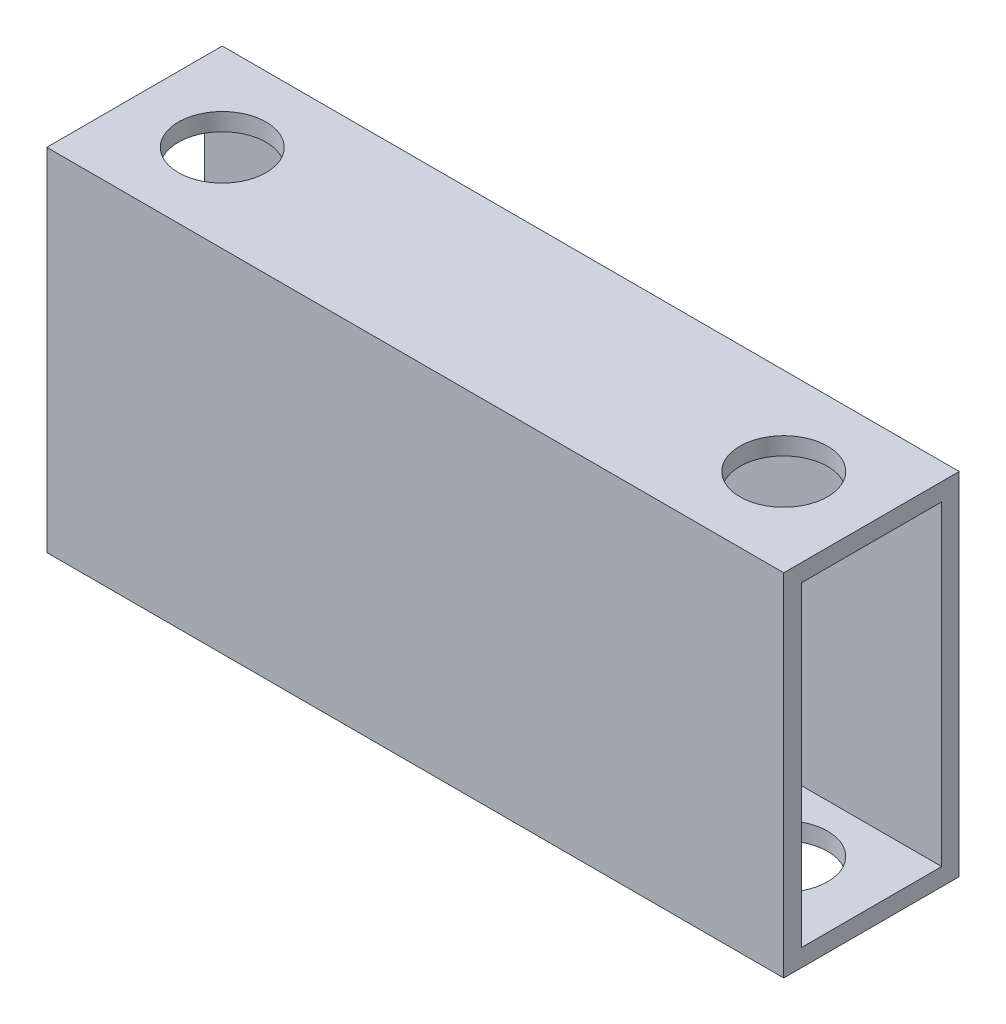
from build123d import *

# Parameters (mm, degrees)
BOSS_EXTRUDE1_DEPTH      = 21
BOSS_EXTRUDE1_DEPTH_BACK = 21
SKETCH1_W                = 10
SKETCH1_H                = 20
SKETCH1_W_2              = 8
SKETCH1_H_2              = 18
SKETCH2_R                = 2.5
CUT_EXTRUDE1_DEPTH       = 20


with BuildPart() as part:
    # Sketch1 → Boss-Extrude1 (new, two sides: drawn at the far end of the back side and taken through both)
    with BuildSketch(Plane(origin=(0, 0, 0), x_dir=(0, 0, -1), z_dir=(1, 0, 0)).offset(-BOSS_EXTRUDE1_DEPTH_BACK)):
        Rectangle(SKETCH1_W, SKETCH1_H)
        Rectangle(SKETCH1_W_2, SKETCH1_H_2, mode=Mode.SUBTRACT)
    extrude(amount=BOSS_EXTRUDE1_DEPTH + BOSS_EXTRUDE1_DEPTH_BACK)

    # Sketch2 → Cut-Extrude1 (cut)
    with BuildSketch(Plane(origin=(0, 10, 0), x_dir=(1, 0, 0), z_dir=(0, 1, 0))):
        with Locations((-16, 0)):
            Circle(SKETCH2_R)
        with Locations((16, 0)):
            Circle(SKETCH2_R)
    extrude(amount=-CUT_EXTRUDE1_DEPTH, mode=Mode.SUBTRACT)


solid = part.part
